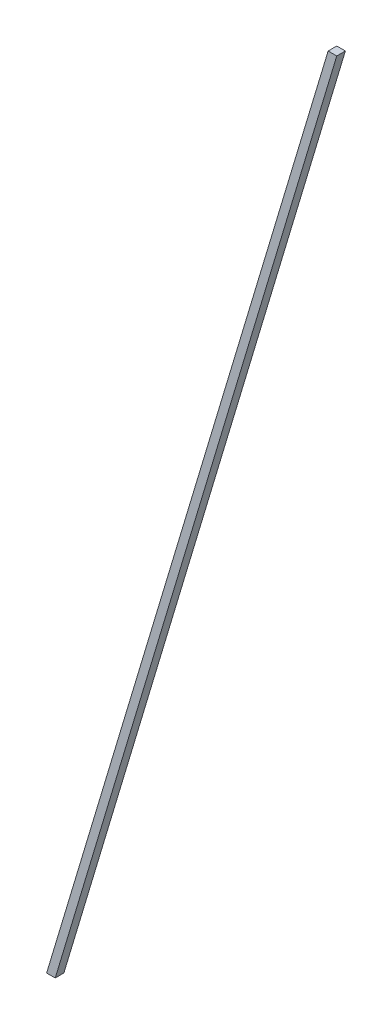
from build123d import *

# Parameters (mm, degrees)
EXTRUDE_1_DEPTH = 3


with BuildPart() as part:
    # Model → 凸台-拉伸1 (new body)
    with BuildSketch(Plane.XY):
        Polygon((166.542522138, 169.098000971), (68.536558189, -157.901999029), (65.536558189, -157.901999029), (163.542522138, 169.098000971), align=None)
    extrude(amount=EXTRUDE_1_DEPTH)


solid = part.part
